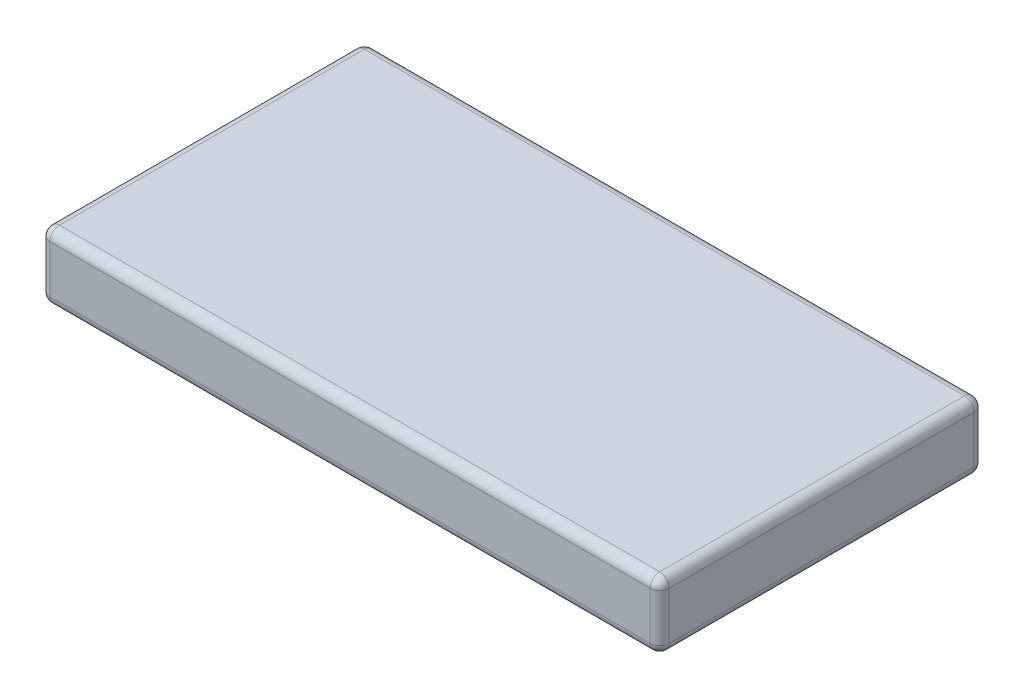
from build123d import *

# Parameters (mm, degrees)
SKETCH1_W           = 65
SKETCH1_H           = 34
BOSS_EXTRUDE1_DEPTH = 7
FILLET1_R           = 1


with BuildPart() as part:
    # Sketch1 → Boss-Extrude1 (new body)
    with BuildSketch(Plane(origin=(0, 0, 0), x_dir=(1, 0, 0), z_dir=(0, 1, 0))):
        Rectangle(SKETCH1_W, SKETCH1_H)
    extrude(amount=BOSS_EXTRUDE1_DEPTH)

    # Fillet1
    fillet1_edges = [part.edges().sort_by_distance(p)[0] for p in [
        (-32.5, 7, 0),
        (0, 7, 17),
        (32.5, 7, 0),
        (0, 0, 17),
        (-32.5, 0, 0),
        (0, 0, -17),
        (32.5, 0, 0),
        (0, 7, -17),
        (32.5, 3.5, 17),
        (-32.5, 3.5, 17),
        (-32.5, 3.5, -17),
        (32.5, 3.5, -17),
    ]]
    fillet(fillet1_edges, radius=FILLET1_R)


solid = part.part
